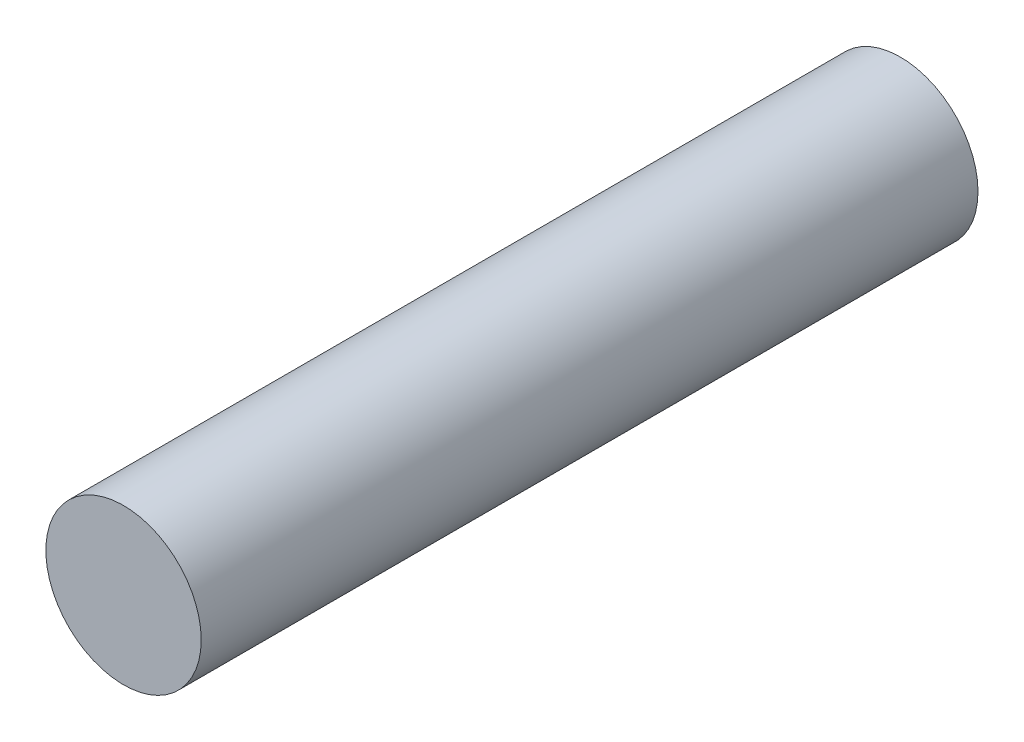
from build123d import *

# Parameters (mm, degrees)
SKETCH_1_R      = 1
EXTRUDE_1_DEPTH = 10


with BuildPart() as part:
    # 草图1 → 凸台-拉伸1 (new body)
    with BuildSketch(Plane.XY):
        with Locations((11.203377337, 3.299069586)):
            Circle(SKETCH_1_R)
    extrude(amount=EXTRUDE_1_DEPTH)


solid = part.part
